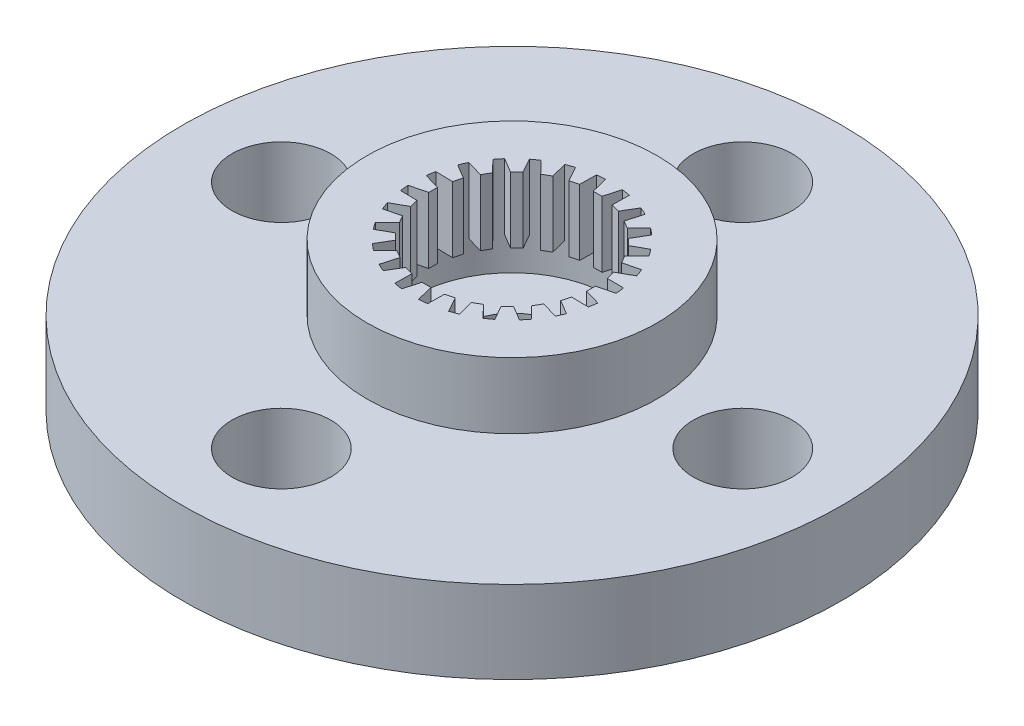
from build123d import *

# Parameters (mm, degrees)
SKETCH_1_W            = 10
SKETCH_1_H            = 2.5
SKETCH_2_R            = 3
CUT_EXTRUDE_1_DEPTH   = 1
EXTRUDE_START         = 2
SKETCH_3_R            = 4.4
EXTRUDE_1_DEPTH       = 2
DRAFT_1_ANGLE         = 15.796571915
DRAFT_2_ANGLE         = 14.203428085
DRAFT_3_ANGLE         = 15.796571915
DRAFT_4_ANGLE         = 14.203428085
DRAFT_5_ANGLE         = 15.796571915
DRAFT_6_ANGLE         = 14.203428085
DRAFT_7_ANGLE         = 15.796571915
DRAFT_8_ANGLE         = 14.203428085
HOLE_WIZARD_3_0_3_1_D = 3
HOLE_WIZARD_3_0_3_2_D = 3


with BuildPart() as part:
    # 草图1 → 旋转1 (revolve)
    with BuildSketch(Plane.XY, mode=Mode.PRIVATE) as revolve_1_sk:
        with Locations((5, 1.25)):
            Rectangle(SKETCH_1_W, SKETCH_1_H)
    revolve(revolve_1_sk.sketch.rotate(Axis((0, 2.5, 0), (0, -1, 0)), 270), axis=Axis((0, 2.5, 0), (0, -1, 0)))

    # 草图2 → 切除-拉伸1 (cut)
    with BuildSketch(Plane(origin=(0, 2.5, 0), x_dir=(-1, 0, 0), z_dir=(0, 1, 0))):
        with Locations(Location((0, 0, 0), (0, 0, 270))):
            Circle(SKETCH_2_R)
    extrude(amount=-CUT_EXTRUDE_1_DEPTH, mode=Mode.SUBTRACT)

    # 草图3 → 凸台-拉伸1 (add)
    with BuildSketch(Plane(origin=(0, 2.5, 0), x_dir=(-1, 0, 0), z_dir=(0, 1, 0)).offset(EXTRUDE_START)):
        with Locations(Location((0, 0, 0), (0, 0, 90))):
            Circle(SKETCH_3_R)
        with BuildLine():
            Line((-1.129315396, -2.779324871), (-0.912145383, -2.414969222))
            Line((-0.912145383, -2.414969222), (-0.6147855, -2.419103624))
            Line((-0.6147855, -2.419103624), (-0.62195587, -2.93482042))
            ThreePointArc((-0.62195587, -2.93482042), (-0.497169888, -2.958516875), (-0.371492698, -2.976910005))
            Line((-0.371492698, -2.976910005), (-0.23538136, -2.495792863))
            Line((-0.23538136, -2.495792863), (0.032272898, -2.495792863))
            Line((0.032272898, -2.495792863), (0.158824181, -2.995792863))
            ThreePointArc((0.158824181, -2.995792863), (0.285491278, -2.986384893), (0.411646614, -2.971623641))
            Line((0.411646614, -2.971623641), (0.418597791, -2.471671962))
            Line((0.418597791, -2.471671962), (0.718181579, -2.475837285))
            Line((0.718181579, -2.475837285), (0.928780626, -2.852606974))
            ThreePointArc((0.928780626, -2.852606974), (1.048696685, -2.810735716), (1.166732889, -2.763826038))
            Line((1.166732889, -2.763826038), (1.044050195, -2.279110702))
            Line((1.044050195, -2.279110702), (1.275845582, -2.145283573))
            Line((1.275845582, -2.145283573), (1.635442207, -2.515020634))
            ThreePointArc((1.635442207, -2.515020634), (1.740435146, -2.443539544), (1.842308246, -2.367678257))
            Line((1.842308246, -2.367678257), (1.598352302, -1.931231814))
            Line((1.598352302, -1.931231814), (1.787612443, -1.741971673))
            Line((1.787612443, -1.741971673), (2.230651104, -2.006039794))
            ThreePointArc((2.230651104, -2.006039794), (2.313565828, -1.909820191), (2.39233334, -1.810177116))
            Line((2.39233334, -1.810177116), (2.043729342, -1.451742669))
            Line((2.043729342, -1.451742669), (2.177556471, -1.219947282))
            Line((2.177556471, -1.219947282), (2.673844814, -1.360350657))
            ThreePointArc((2.673844814, -1.360350657), (2.729030822, -1.245949748), (2.779324871, -1.129315396))
            Line((2.779324871, -1.129315396), (2.414969222, -0.912145383))
            Line((2.414969222, -0.912145383), (2.419103624, -0.6147855))
            Line((2.419103624, -0.6147855), (2.93482042, -0.62195587))
            ThreePointArc((2.93482042, -0.62195587), (2.958516875, -0.497169888), (2.976910005, -0.371492698))
            Line((2.976910005, -0.371492698), (2.495792863, -0.23538136))
            Line((2.495792863, -0.23538136), (2.495792863, 0.032272898))
            Line((2.495792863, 0.032272898), (2.995792863, 0.158824181))
            ThreePointArc((2.995792863, 0.158824181), (2.986384893, 0.285491278), (2.971623641, 0.411646614))
            Line((2.971623641, 0.411646614), (2.471671962, 0.418597791))
            Line((2.471671962, 0.418597791), (2.475837285, 0.718181579))
            Line((2.475837285, 0.718181579), (2.852606974, 0.928780626))
            ThreePointArc((2.852606974, 0.928780626), (2.810735716, 1.048696685), (2.763826038, 1.166732889))
            Line((2.763826038, 1.166732889), (2.279110702, 1.044050195))
            Line((2.279110702, 1.044050195), (2.145283573, 1.275845582))
            Line((2.145283573, 1.275845582), (2.515020634, 1.635442207))
            ThreePointArc((2.515020634, 1.635442207), (2.443539544, 1.740435146), (2.367678257, 1.842308246))
            Line((2.367678257, 1.842308246), (1.931231814, 1.598352302))
            Line((1.931231814, 1.598352302), (1.741971673, 1.787612443))
            Line((1.741971673, 1.787612443), (2.006039794, 2.230651104))
            ThreePointArc((2.006039794, 2.230651104), (1.909820191, 2.313565828), (1.810177116, 2.39233334))
            Line((1.810177116, 2.39233334), (1.451742669, 2.043729342))
            Line((1.451742669, 2.043729342), (1.219947282, 2.177556471))
            Line((1.219947282, 2.177556471), (1.360350657, 2.673844814))
            ThreePointArc((1.360350657, 2.673844814), (1.245949748, 2.729030822), (1.129315396, 2.779324871))
            Line((1.129315396, 2.779324871), (0.912145383, 2.414969222))
            Line((0.912145383, 2.414969222), (0.6147855, 2.419103624))
            Line((0.6147855, 2.419103624), (0.62195587, 2.93482042))
            ThreePointArc((0.62195587, 2.93482042), (0.497169888, 2.958516875), (0.371492698, 2.976910005))
            Line((0.371492698, 2.976910005), (0.23538136, 2.495792863))
            Line((0.23538136, 2.495792863), (-0.032272898, 2.495792863))
            Line((-0.032272898, 2.495792863), (-0.158824181, 2.995792863))
            ThreePointArc((-0.158824181, 2.995792863), (-0.285491278, 2.986384893), (-0.411646614, 2.971623641))
            Line((-0.411646614, 2.971623641), (-0.418597791, 2.471671962))
            Line((-0.418597791, 2.471671962), (-0.718181579, 2.475837285))
            Line((-0.718181579, 2.475837285), (-0.928780626, 2.852606974))
            ThreePointArc((-0.928780626, 2.852606974), (-1.048696685, 2.810735716), (-1.166732889, 2.763826038))
            Line((-1.166732889, 2.763826038), (-1.044050195, 2.279110702))
            Line((-1.044050195, 2.279110702), (-1.275845582, 2.145283573))
            Line((-1.275845582, 2.145283573), (-1.635442207, 2.515020634))
            ThreePointArc((-1.635442207, 2.515020634), (-1.740435146, 2.443539544), (-1.842308246, 2.367678257))
            Line((-1.842308246, 2.367678257), (-1.598352302, 1.931231814))
            Line((-1.598352302, 1.931231814), (-1.787612443, 1.741971673))
            Line((-1.787612443, 1.741971673), (-2.230651104, 2.006039794))
            ThreePointArc((-2.230651104, 2.006039794), (-2.313565828, 1.909820191), (-2.39233334, 1.810177116))
            Line((-2.39233334, 1.810177116), (-2.043729342, 1.451742669))
            Line((-2.043729342, 1.451742669), (-2.177556471, 1.219947282))
            Line((-2.177556471, 1.219947282), (-2.673844814, 1.360350657))
            ThreePointArc((-2.673844814, 1.360350657), (-2.729030822, 1.245949748), (-2.779324871, 1.129315396))
            Line((-2.779324871, 1.129315396), (-2.414969222, 0.912145383))
            Line((-2.414969222, 0.912145383), (-2.419103624, 0.6147855))
            Line((-2.419103624, 0.6147855), (-2.93482042, 0.62195587))
            ThreePointArc((-2.93482042, 0.62195587), (-2.958516875, 0.497169888), (-2.976910005, 0.371492698))
            Line((-2.976910005, 0.371492698), (-2.495792863, 0.23538136))
            Line((-2.495792863, 0.23538136), (-2.495792863, -0.032272898))
            Line((-2.495792863, -0.032272898), (-2.995792863, -0.158824181))
            ThreePointArc((-2.995792863, -0.158824181), (-2.986384893, -0.285491278), (-2.971623641, -0.411646614))
            Line((-2.971623641, -0.411646614), (-2.471671962, -0.418597791))
            Line((-2.471671962, -0.418597791), (-2.475837285, -0.718181579))
            Line((-2.475837285, -0.718181579), (-2.852606974, -0.928780626))
            ThreePointArc((-2.852606974, -0.928780626), (-2.810735716, -1.048696685), (-2.763826038, -1.166732889))
            Line((-2.763826038, -1.166732889), (-2.279110702, -1.044050195))
            Line((-2.279110702, -1.044050195), (-2.145283573, -1.275845582))
            Line((-2.145283573, -1.275845582), (-2.515020634, -1.635442207))
            ThreePointArc((-2.515020634, -1.635442207), (-2.443539544, -1.740435146), (-2.367678257, -1.842308246))
            Line((-2.367678257, -1.842308246), (-1.931231814, -1.598352302))
            Line((-1.931231814, -1.598352302), (-1.741971673, -1.787612443))
            Line((-1.741971673, -1.787612443), (-2.006039794, -2.230651104))
            ThreePointArc((-2.006039794, -2.230651104), (-1.909820191, -2.313565828), (-1.810177116, -2.39233334))
            Line((-1.810177116, -2.39233334), (-1.451742669, -2.043729342))
            Line((-1.451742669, -2.043729342), (-1.219947282, -2.177556471))
            Line((-1.219947282, -2.177556471), (-1.360350657, -2.673844814))
            ThreePointArc((-1.360350657, -2.673844814), (-1.245949748, -2.729030822), (-1.129315396, -2.779324871))
        make_face(mode=Mode.SUBTRACT)
    extrude(amount=-EXTRUDE_1_DEPTH)

    # 拔模1
    draft_1_faces = [part.faces().sort_by_distance(p)[0] for p in [
        (-0.568389685, 3.5, -2.473754624),
    ]]
    draft(draft_1_faces, Plane(origin=(-0.411646614, 4.5, -2.971623641), x_dir=(-0.013902354777541768, 0, 0.9999033575959425), z_dir=(0.9999033575959425, 0, 0.013902354777541768)), DRAFT_1_ANGLE)

    # 拔模2
    draft_2_faces = [part.faces().sort_by_distance(p)[0] for p in [
        (-2.417036423, 3.5, -0.763465441),
    ]]
    draft(draft_2_faces, Plane(origin=(-2.419103624, 4.5, -0.6147855), x_dir=(0.9999033575959425, 0, 0.013902354777546031), z_dir=(-0.013902354777546031, 0, 0.9999033575959425)), DRAFT_2_ANGLE)

    # 拔模3
    draft_3_faces = [part.faces().sort_by_distance(p)[0] for p in [
        (-2.473754624, 3.5, 0.568389685),
    ]]
    draft(draft_3_faces, Plane(origin=(-2.971623641, 4.5, 0.411646614), x_dir=(-0.9999033575959426, 0, -0.013902354777538168), z_dir=(0.013902354777538168, 0, -0.9999033575959426)), DRAFT_3_ANGLE)

    # 拔模4
    draft_4_faces = [part.faces().sort_by_distance(p)[0] for p in [
        (-0.763465441, 3.5, 2.417036423),
    ]]
    draft(draft_4_faces, Plane(origin=(-0.6147855, 4.5, 2.419103624), x_dir=(-0.013902354777542914, 0, 0.9999033575959425), z_dir=(0.9999033575959425, 0, 0.013902354777542914)), DRAFT_4_ANGLE)

    # 拔模5
    draft_5_faces = [part.faces().sort_by_distance(p)[0] for p in [
        (0.568389685, 3.5, 2.473754624),
    ]]
    draft(draft_5_faces, Plane(origin=(0.411646614, 4.5, 2.971623641), x_dir=(0.013902354777534265, 0, -0.9999033575959427), z_dir=(-0.9999033575959427, 0, -0.013902354777534265)), DRAFT_5_ANGLE)

    # 拔模6
    draft_6_faces = [part.faces().sort_by_distance(p)[0] for p in [
        (2.417036423, 3.5, 0.763465441),
    ]]
    draft(draft_6_faces, Plane(origin=(2.419103624, 4.5, 0.6147855), x_dir=(-0.9999033575959426, 0, -0.013902354777538045), z_dir=(0.013902354777538045, 0, -0.9999033575959426)), DRAFT_6_ANGLE)

    # 拔模7
    draft_7_faces = [part.faces().sort_by_distance(p)[0] for p in [
        (2.473754624, 3.5, -0.568389685),
    ]]
    draft(draft_7_faces, Plane(origin=(2.971623641, 4.5, -0.411646614), x_dir=(0.9999033575959425, 0, 0.013902354777544345), z_dir=(-0.013902354777544345, 0, 0.9999033575959425)), DRAFT_7_ANGLE)

    # 拔模8
    draft_8_faces = [part.faces().sort_by_distance(p)[0] for p in [
        (0.763465441, 3.5, -2.417036423),
    ]]
    draft(draft_8_faces, Plane(origin=(0.6147855, 4.5, -2.419103624), x_dir=(0.013902354777548974, 0, -0.9999033575959425), z_dir=(-0.9999033575959425, 0, -0.013902354777548974)), DRAFT_8_ANGLE)

    # Ø3.0 (3) 直径孔1 (through all)
    with Locations(Plane(origin=(0, 1.5, 0), x_dir=(1, 0, 0), z_dir=(0, 1, 0))):
        with Locations((0, 0)):
            Hole(HOLE_WIZARD_3_0_3_1_D / 2)

    # Ø3.0 (3) 直径孔2 (through all)
    with Locations(Plane(origin=(0, 2.5, 0), x_dir=(1, 0, 0), z_dir=(0, 1, 0))):
        with Locations((0, -7), (-7, 0), (7, 0), (0, 7)):
            Hole(HOLE_WIZARD_3_0_3_2_D / 2)


solid = part.part
